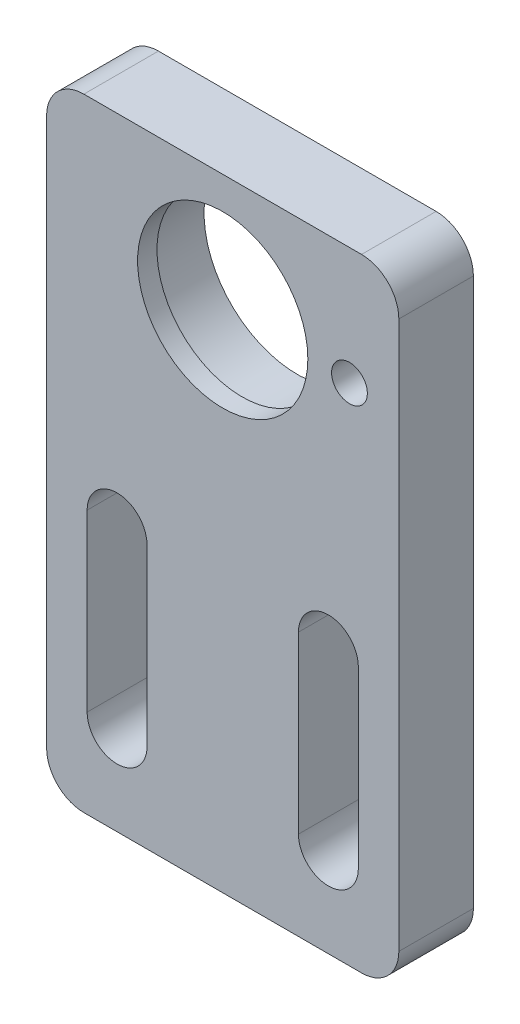
from build123d import *

# Parameters (mm, degrees)
SKETCH1_R           = 1.524
SKETCH1_R_2         = 7.250000001
BOSS_EXTRUDE1_DEPTH = 6.35
SKETCH1_3_R         = 7.9375
SKETCH1_3_R_2       = 7.250000001
CUT_EXTRUDE1_DEPTH  = 4.699


with BuildPart() as part:
    # Sketch1 → Boss-Extrude1 (new body)
    with BuildSketch(Plane.XY):
        with BuildLine():
            ThreePointArc((360.683701588, 243.958854223), (361.613637557, 241.713790192), (363.858701588, 240.783854223))
            Line((363.858701588, 240.783854223), (387.508701588, 240.783854223))
            ThreePointArc((387.508701588, 240.783854223), (389.753765618, 241.713790192), (390.683701588, 243.958854223))
            Line((390.683701588, 243.958854223), (390.683701588, 290.608854224))
            ThreePointArc((390.683701588, 290.608854224), (389.753765618, 292.853918255), (387.508701588, 293.783854224))
            Line((387.508701588, 293.783854224), (363.858701588, 293.783854224))
            ThreePointArc((363.858701588, 293.783854224), (361.613637557, 292.853918255), (360.683701588, 290.608854224))
            Line((360.683701588, 290.608854224), (360.683701588, 243.958854223))
        make_face()
        with BuildLine():
            ThreePointArc((369.233701587, 248.333854223), (366.683701588, 245.783854224), (364.133701589, 248.333854223))
            Line((364.133701589, 248.333854223), (364.133701589, 263.233854225))
            ThreePointArc((364.133701589, 263.233854225), (366.683701588, 265.783854224), (369.233701587, 263.233854225))
            Line((369.233701587, 263.233854225), (369.233701587, 248.333854223))
        make_face(mode=Mode.SUBTRACT)
        with BuildLine():
            Line((382.133701588, 248.333854223), (382.133701588, 263.233854225))
            ThreePointArc((382.133701588, 263.233854225), (384.683701589, 265.783854225), (387.233701589, 263.233854225))
            Line((387.233701589, 263.233854225), (387.233701589, 248.333854223))
            ThreePointArc((387.233701589, 248.333854223), (384.683701589, 245.783854223), (382.133701588, 248.333854223))
        make_face(mode=Mode.SUBTRACT)
        with Locations((386.478701588, 283.783854224)):
            Circle(SKETCH1_R, mode=Mode.SUBTRACT)
        with Locations((375.683701588, 283.783854224)):
            Circle(SKETCH1_R_2, mode=Mode.SUBTRACT)
    extrude(amount=BOSS_EXTRUDE1_DEPTH)

    # Sketch1<3> → Cut-Extrude1 (cut)
    with BuildSketch(Plane.XY):
        with Locations((375.683701588, 283.783854224)):
            Circle(SKETCH1_3_R)
        with Locations((375.683701588, 283.783854224)):
            Circle(SKETCH1_3_R_2, mode=Mode.SUBTRACT)
    extrude(amount=CUT_EXTRUDE1_DEPTH, mode=Mode.SUBTRACT)


solid = part.part
